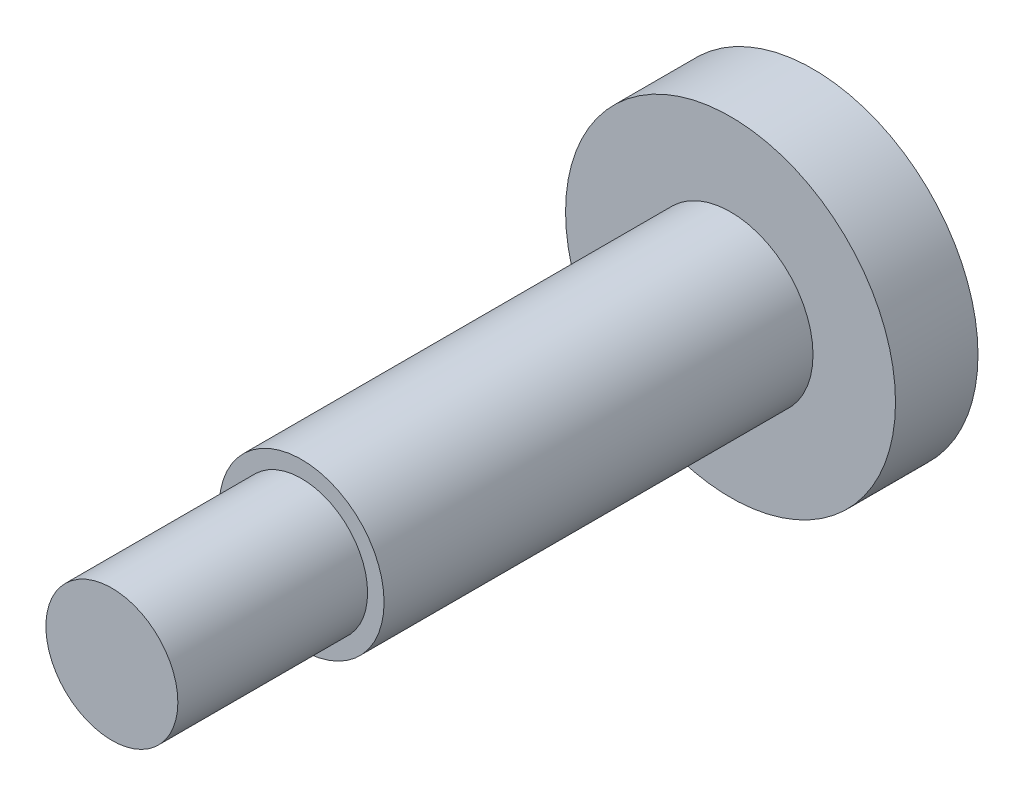
from build123d import *

# Parameters (mm, degrees)
REFERENCE_HEAD_START           = -1
SKETCH1_R                      = 2
REFERENCE_HEAD_DEPTH           = 1
SKETCH2_R                      = 1
REFERENCE_SHANK_DEPTH          = 7.5
SKETCH3_R                      = 1.01
SKETCH3_R_2                    = 0.8
M1P6_END_THREAD_ENVELOPE_DEPTH = 2.3


with BuildPart() as part:
    # Sketch1 → Reference_Head (new body)
    with BuildSketch(Plane.XY.offset(REFERENCE_HEAD_START)):
        Circle(SKETCH1_R)
    extrude(amount=REFERENCE_HEAD_DEPTH)

    # Sketch2 → Reference_Shank (add)
    with BuildSketch(Plane.XY):
        Circle(SKETCH2_R)
    extrude(amount=REFERENCE_SHANK_DEPTH)

    # Sketch3 → M1p6_End_Thread_Envelope (cut)
    with BuildSketch(Plane.XY.offset(7.5)):
        Circle(SKETCH3_R)
        Circle(SKETCH3_R_2, mode=Mode.SUBTRACT)
    extrude(amount=-M1P6_END_THREAD_ENVELOPE_DEPTH, mode=Mode.SUBTRACT)


solid = part.part
